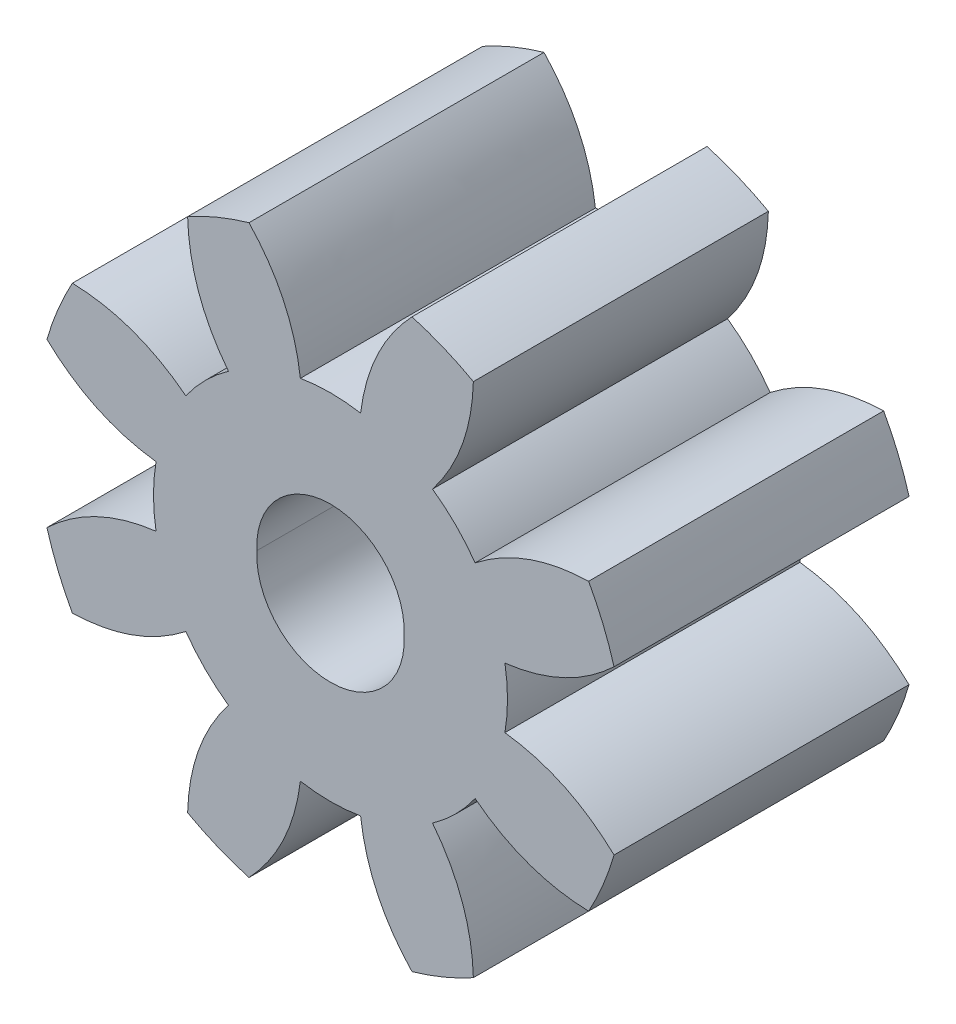
from build123d import *

# Parameters (mm, degrees)
SKETCH1_R           = 2.5
BOSS_EXTRUDE2_DEPTH = 10
CUT_EXTRUDE1_REACH  = 18.874
SKETCH2_R           = 2.5


with BuildPart() as part:
    # Sketch1 → Boss-Extrude2 (new body)
    with BuildSketch(Plane.XY):
        with BuildLine():
            add(Edge.make_bspline(
                [(9.610904716, 2.762337877), (8.044691719, 1.282669722), (5.912491895, 1.020999313)],
                knots=[0, 0, 0, 1, 1, 1], degree=2))
            ThreePointArc((9.610904716, 2.762337877), (9.238795325, 3.826834324), (8.749203742, 4.842668053))
            add(Edge.make_bspline(
                [(8.749203742, 4.842668053), (6.595440526, 4.781471609), (4.90271865, 3.458807575)],
                knots=[0, 0, 0, 1, 1, 1], degree=2))
            ThreePointArc((4.90271865, 3.458807575), (4.242640687, 4.242640687), (3.458807575, 4.90271865))
            add(Edge.make_bspline(
                [(4.842668053, 8.749203742), (4.781471609, 6.595440526), (3.458807575, 4.90271865)],
                knots=[0, 0, 0, 1, 1, 1], degree=2))
            ThreePointArc((4.842668053, 8.749203742), (3.826834324, 9.238795325), (2.762337877, 9.610904716))
            add(Edge.make_bspline(
                [(2.762337877, 9.610904716), (1.282669722, 8.044691719), (1.020999313, 5.912491895)],
                knots=[0, 0, 0, 1, 1, 1], degree=2))
            ThreePointArc((1.020999313, 5.912491895), (0, 6), (-1.020999313, 5.912491895))
            add(Edge.make_bspline(
                [(-2.762337877, 9.610904716), (-1.282669722, 8.044691719), (-1.020999313, 5.912491895)],
                knots=[0, 0, 0, 1, 1, 1], degree=2))
            ThreePointArc((-2.762337877, 9.610904716), (-3.826834324, 9.238795325), (-4.842668053, 8.749203742))
            add(Edge.make_bspline(
                [(-4.842668053, 8.749203742), (-4.781471609, 6.595440526), (-3.458807575, 4.90271865)],
                knots=[0, 0, 0, 1, 1, 1], degree=2))
            ThreePointArc((-3.458807575, 4.90271865), (-4.242640687, 4.242640687), (-4.90271865, 3.458807575))
            add(Edge.make_bspline(
                [(-8.749203742, 4.842668053), (-6.595440526, 4.781471609), (-4.90271865, 3.458807575)],
                knots=[0, 0, 0, 1, 1, 1], degree=2))
            ThreePointArc((-8.749203742, 4.842668053), (-9.238795325, 3.826834324), (-9.610904716, 2.762337877))
            add(Edge.make_bspline(
                [(-9.610904716, 2.762337877), (-8.044691719, 1.282669722), (-5.912491895, 1.020999313)],
                knots=[0, 0, 0, 1, 1, 1], degree=2))
            ThreePointArc((-5.912491895, 1.020999313), (-6, 0), (-5.912491895, -1.020999313))
            add(Edge.make_bspline(
                [(-9.610904716, -2.762337877), (-8.044691719, -1.282669722), (-5.912491895, -1.020999313)],
                knots=[0, 0, 0, 1, 1, 1], degree=2))
            ThreePointArc((-9.610904716, -2.762337877), (-9.238795325, -3.826834324), (-8.749203742, -4.842668053))
            add(Edge.make_bspline(
                [(-8.749203742, -4.842668053), (-6.595440526, -4.781471609), (-4.90271865, -3.458807575)],
                knots=[0, 0, 0, 1, 1, 1], degree=2))
            ThreePointArc((-4.90271865, -3.458807575), (-4.242640687, -4.242640687), (-3.458807575, -4.90271865))
            add(Edge.make_bspline(
                [(-4.842668053, -8.749203742), (-4.781471609, -6.595440526), (-3.458807575, -4.90271865)],
                knots=[0, 0, 0, 1, 1, 1], degree=2))
            ThreePointArc((-4.842668053, -8.749203742), (-3.826834324, -9.238795325), (-2.762337877, -9.610904716))
            add(Edge.make_bspline(
                [(-2.762337877, -9.610904716), (-1.282669722, -8.044691719), (-1.020999313, -5.912491895)],
                knots=[0, 0, 0, 1, 1, 1], degree=2))
            ThreePointArc((-1.020999313, -5.912491895), (0, -6), (1.020999313, -5.912491895))
            add(Edge.make_bspline(
                [(2.762337877, -9.610904716), (1.282669722, -8.044691719), (1.020999313, -5.912491895)],
                knots=[0, 0, 0, 1, 1, 1], degree=2))
            ThreePointArc((2.762337877, -9.610904716), (3.826834324, -9.238795325), (4.842668053, -8.749203742))
            add(Edge.make_bspline(
                [(4.842668053, -8.749203742), (4.781471609, -6.595440526), (3.458807575, -4.90271865)],
                knots=[0, 0, 0, 1, 1, 1], degree=2))
            ThreePointArc((3.458807575, -4.90271865), (4.242640687, -4.242640687), (4.90271865, -3.458807575))
            add(Edge.make_bspline(
                [(8.749203742, -4.842668053), (6.595440526, -4.781471609), (4.90271865, -3.458807575)],
                knots=[0, 0, 0, 1, 1, 1], degree=2))
            ThreePointArc((8.749203742, -4.842668053), (9.238795325, -3.826834324), (9.610904716, -2.762337877))
            add(Edge.make_bspline(
                [(9.610904716, -2.762337877), (8.044691719, -1.282669722), (5.912491895, -1.020999313)],
                knots=[0, 0, 0, 1, 1, 1], degree=2))
            ThreePointArc((5.912491895, -1.020999313), (6, 0), (5.912491895, 1.020999313))
        make_face()
        with Locations((0, 0.23341784)):
            Circle(SKETCH1_R, mode=Mode.SUBTRACT)
    extrude(amount=BOSS_EXTRUDE2_DEPTH)

    # Sketch2 → Cut-Extrude1 (cut, up to next)
    with BuildSketch(Plane.XY.offset(10), mode=Mode.PRIVATE) as cut_extrude1_sk1:
        Circle(SKETCH2_R)
    cut_extrude1_tool1 = extrude(cut_extrude1_sk1.sketch, amount=-CUT_EXTRUDE1_REACH, mode=Mode.PRIVATE) & part.part
    add(cut_extrude1_tool1.solids().sort_by_distance((0, 0, 10))[0], mode=Mode.SUBTRACT)


solid = part.part
